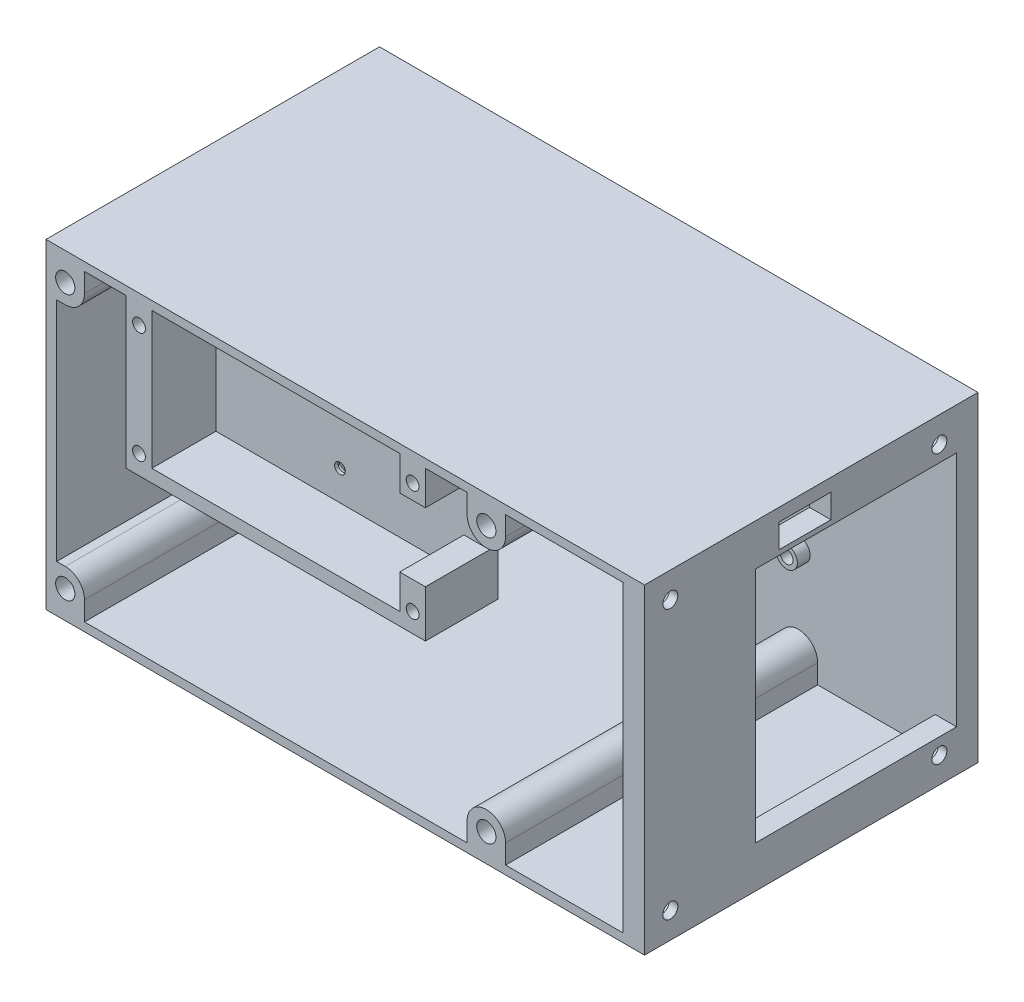
from build123d import *

# Parameters (mm, degrees)
SZKIC1_W                         = 140
SZKIC1_H                         = 75
SZKIC1_R                         = 2
SZKIC1_R_2                       = 1.5
DODANIE_WYCI_GNI_CIE1_DEPTH      = 5
SZKIC2_R                         = 2
SZKIC2_R_2                       = 1.5
WYTNIJ_WYCI_GNI_CIE1_DEPTH       = 3
SZKIC4_R                         = 4
SZKIC4_R_2                       = 2
SZKIC4_R_3                       = 2.5
SZKIC4_R_4                       = 1.5
DODANIE_WYCI_GNI_CIE3_DEPTH      = 3
SZKIC7_W                         = 140
SZKIC7_H                         = 75
DODANIE_WYCI_GNI_CIE5_DEPTH      = 73
WYTNIJ_WYCI_GNI_CIE2_REACH       = 178.943
SZKIC8_W                         = 47
SZKIC8_H                         = 55.5
SZKIC9_R                         = 2.25
WYTNIJ_WYCI_GNI_CIE3_DEPTH       = 177.943493805
WYTNIJ_WYCI_GNI_CIE4_DEPTH       = 47
SZKIC12_W                        = 70
SZKIC12_H                        = 2
DODANIE_WYCI_GNI_CIE6_DEPTH      = 35
SZKIC13_W                        = 6
SZKIC13_H                        = 8
DODANIE_WYCI_GNI_CIE7_DEPTH      = 15
WYTNIJ_WYCI_GNI_CIE5_REACH       = 172.863
SZKIC14_R                        = 1.25
WYTNIJ_WYCI_GNI_CIE6_START       = -1.2
SZKIC15_R                        = 1.25
WYTNIJ_WYCI_GNI_CIE6_DEPTH       = 1.2
WYTNIJ_WYCI_GNI_CIE7_REACH       = 178.943
SZKIC16_R                        = 1.5
WYTNIJ_WYCI_GNI_CIE8_START       = -13
SZKIC18_R                        = 1.5
WYTNIJ_WYCI_GNI_CIE8_DEPTH       = 13
WYTNIJ_WYCI_GNI_CIE9_REACH       = 178.943
SZKIC20_R                        = 1.75
WYTNIJ_WYCI_GNI_CIE10_DEPTH      = 5
WYTNIJ_WYCI_GNI_CIE10_DEPTH_BACK = 3
WYTNIJ_WYCI_GNI_CIE11_REACH      = 178.943
WYTNIJ_WYCI_GNI_CIE12_DEPTH      = 2.1
WYTNIJ_WYCI_GNI_CIE13_REACH      = 178.943
SZKIC24_W                        = 12.2
SZKIC24_H                        = 5.6


with BuildPart() as part:
    # Szkic1 → Dodanie-wyciągnięcie1 (new body)
    with BuildSketch(Plane.XY):
        with Locations((70, 37.5)):
            Rectangle(SZKIC1_W, SZKIC1_H)
        with Locations((6.6, 58.05)):
            Circle(SZKIC1_R, mode=Mode.SUBTRACT)
        with Locations((6.6, 16.95)):
            Circle(SZKIC1_R, mode=Mode.SUBTRACT)
        with Locations((69.3, 58.05)):
            Circle(SZKIC1_R, mode=Mode.SUBTRACT)
        with Locations((69.3, 16.95)):
            Circle(SZKIC1_R, mode=Mode.SUBTRACT)
        with Locations((90.54, 47.66)):
            Circle(SZKIC1_R_2, mode=Mode.SUBTRACT)
        with Locations(Location((103.24, 47.66, 0), (0, 0, 180))):
            Circle(SZKIC1_R_2, mode=Mode.SUBTRACT)
        with Locations((103.24, 27.34)):
            Circle(SZKIC1_R_2, mode=Mode.SUBTRACT)
        with Locations(Location((90.54, 27.34, 0), (0, 0, 180))):
            Circle(SZKIC1_R_2, mode=Mode.SUBTRACT)
    extrude(amount=DODANIE_WYCI_GNI_CIE1_DEPTH)

    # Szkic2 → Wytnij-wyciągnięcie1 (cut)
    # profile 1 of 8: a face of its own
    with BuildSketch(Plane(origin=(0, 0, 0), x_dir=(-1, 0, 0), z_dir=(0, 0, -1))):
        Polygon((-72.35, 59.810918321), (-69.3, 61.571836642), (-66.25, 59.810918321), (-66.25, 56.289081679), (-69.3, 54.528163358), (-72.35, 56.289081679), align=None)
        with Locations((-69.3, 58.05)):
            Circle(SZKIC2_R, mode=Mode.SUBTRACT)
    # profile 2 of 8: a face of its own
    with BuildSketch(Plane(origin=(0, 0, 0), x_dir=(-1, 0, 0), z_dir=(0, 0, -1))):
        Polygon((-6.6, 54.528163358), (-3.55, 56.289081679), (-3.55, 59.810918321), (-6.6, 61.571836642), (-9.65, 59.810918321), (-9.65, 56.289081679), align=None)
        with Locations((-6.6, 58.05)):
            Circle(SZKIC2_R, mode=Mode.SUBTRACT)
    # profile 3 of 8: a face of its own
    with BuildSketch(Plane(origin=(0, 0, 0), x_dir=(-1, 0, 0), z_dir=(0, 0, -1))):
        Polygon((-9.65, 18.710918321), (-6.6, 20.471836642), (-3.55, 18.710918321), (-3.55, 15.189081679), (-6.6, 13.428163358), (-9.65, 15.189081679), align=None)
        with Locations((-6.6, 16.95)):
            Circle(SZKIC2_R, mode=Mode.SUBTRACT)
    # profile 4 of 8: a face of its own
    with BuildSketch(Plane(origin=(0, 0, 0), x_dir=(-1, 0, 0), z_dir=(0, 0, -1))):
        Polygon((-69.3, 20.471836642), (-72.35, 18.710918321), (-72.35, 15.189081679), (-69.3, 13.428163358), (-66.25, 15.189081679), (-66.25, 18.710918321), align=None)
        with Locations((-69.3, 16.95)):
            Circle(SZKIC2_R, mode=Mode.SUBTRACT)
    # profile 5 of 8: a face of its own
    with BuildSketch(Plane(origin=(0, 0, 0), x_dir=(-1, 0, 0), z_dir=(0, 0, -1))):
        Polygon((-93.09, 49.132243186), (-90.54, 50.604486373), (-87.99, 49.132243186), (-87.99, 46.187756814), (-90.54, 44.715513627), (-93.09, 46.187756814), align=None)
        with Locations((-90.54, 47.66)):
            Circle(SZKIC2_R_2, mode=Mode.SUBTRACT)
    # profile 6 of 8: a face of its own
    with BuildSketch(Plane(origin=(0, 0, 0), x_dir=(-1, 0, 0), z_dir=(0, 0, -1))):
        Polygon((-103.24, 44.715513627), (-100.69, 46.187756814), (-100.69, 49.132243186), (-103.24, 50.604486373), (-105.79, 49.132243186), (-105.79, 46.187756814), align=None)
        with Locations((-103.24, 47.66)):
            Circle(SZKIC2_R_2, mode=Mode.SUBTRACT)
    # profile 7 of 8: a face of its own
    with BuildSketch(Plane(origin=(0, 0, 0), x_dir=(-1, 0, 0), z_dir=(0, 0, -1))):
        Polygon((-90.54, 30.284486373), (-93.09, 28.812243186), (-93.09, 25.867756814), (-90.54, 24.395513627), (-87.99, 25.867756814), (-87.99, 28.812243186), align=None)
        with Locations((-90.54, 27.34)):
            Circle(SZKIC2_R_2, mode=Mode.SUBTRACT)
    # profile 8 of 8: a face of its own
    with BuildSketch(Plane(origin=(0, 0, 0), x_dir=(-1, 0, 0), z_dir=(0, 0, -1))):
        Polygon((-105.79, 25.867756814), (-105.79, 28.812243186), (-103.24, 30.284486373), (-100.69, 28.812243186), (-100.69, 25.867756814), (-103.24, 24.395513627), align=None)
        with Locations((-103.24, 27.34)):
            Circle(SZKIC2_R_2, mode=Mode.SUBTRACT)
    extrude(amount=-WYTNIJ_WYCI_GNI_CIE1_DEPTH, mode=Mode.SUBTRACT)

    # Szkic4 → Dodanie-wyciągnięcie3 (add)
    # profile 1 of 8: a face of its own
    with BuildSketch(Plane.XY.offset(5)):
        with Locations(Location((6.6, 58.05, 0), (0, 0, 180))):
            Circle(SZKIC4_R)
        with Locations(Location((6.6, 58.05, 0), (0, 0, 180))):
            Circle(SZKIC4_R_2, mode=Mode.SUBTRACT)
    # profile 2 of 8: a face of its own
    with BuildSketch(Plane.XY.offset(5)):
        with Locations(Location((69.3, 58.05, 0), (0, 0, 180))):
            Circle(SZKIC4_R)
        with Locations(Location((69.3, 58.05, 0), (0, 0, 180))):
            Circle(SZKIC4_R_2, mode=Mode.SUBTRACT)
    # profile 3 of 8: a face of its own
    with BuildSketch(Plane.XY.offset(5)):
        with Locations(Location((6.6, 16.95, 0), (0, 0, 180))):
            Circle(SZKIC4_R)
        with Locations(Location((6.6, 16.95, 0), (0, 0, 180))):
            Circle(SZKIC4_R_2, mode=Mode.SUBTRACT)
    # profile 4 of 8: a face of its own
    with BuildSketch(Plane.XY.offset(5)):
        with Locations(Location((69.3, 16.95, 0), (0, 0, 180))):
            Circle(SZKIC4_R)
        with Locations(Location((69.3, 16.95, 0), (0, 0, 180))):
            Circle(SZKIC4_R_2, mode=Mode.SUBTRACT)
    # profile 5 of 8: a face of its own
    with BuildSketch(Plane.XY.offset(5)):
        with Locations(Location((90.54, 47.66, 0), (0, 0, 180))):
            Circle(SZKIC4_R_3)
        with Locations(Location((90.54, 47.66, 0), (0, 0, 180))):
            Circle(SZKIC4_R_4, mode=Mode.SUBTRACT)
    # profile 6 of 8: a face of its own
    with BuildSketch(Plane.XY.offset(5)):
        with Locations(Location((103.24, 47.66, 0), (0, 0, 180))):
            Circle(SZKIC4_R_3)
        with Locations(Location((103.24, 47.66, 0), (0, 0, 180))):
            Circle(SZKIC4_R_4, mode=Mode.SUBTRACT)
    # profile 7 of 8: a face of its own
    with BuildSketch(Plane.XY.offset(5)):
        with Locations(Location((90.54, 27.34, 0), (0, 0, 180))):
            Circle(SZKIC4_R_3)
        with Locations(Location((90.54, 27.34, 0), (0, 0, 180))):
            Circle(SZKIC4_R_4, mode=Mode.SUBTRACT)
    # profile 8 of 8: a face of its own
    with BuildSketch(Plane.XY.offset(5)):
        with Locations(Location((103.24, 27.34, 0), (0, 0, 180))):
            Circle(SZKIC4_R_3)
        with Locations(Location((103.24, 27.34, 0), (0, 0, 180))):
            Circle(SZKIC4_R_4, mode=Mode.SUBTRACT)
    extrude(amount=DODANIE_WYCI_GNI_CIE3_DEPTH)

    # Szkic7 → Dodanie-wyciągnięcie5 (add)
    with BuildSketch(Plane.XY.offset(5)):
        with Locations((70, 37.5)):
            Rectangle(SZKIC7_W, SZKIC7_H)
        with BuildLine():
            Line((2.5, 11), (2.5, 64))
            Line((2.5, 64), (4.5, 64))
            ThreePointArc((4.5, 64), (7.681980515, 65.318019485), (9, 68.5))
            Line((9, 68.5), (9, 73))
            Line((9, 73), (98.5, 73))
            Line((98.5, 73), (98.5, 68.5))
            ThreePointArc((98.5, 68.5), (103, 64), (107.5, 68.5))
            Line((107.5, 68.5), (107.5, 73))
            Line((107.5, 73), (135, 73))
            Line((135, 73), (135, 2))
            Line((135, 2), (107.5, 2))
            Line((107.5, 2), (107.5, 6.5))
            ThreePointArc((107.5, 6.5), (103, 11), (98.5, 6.5))
            Line((98.5, 6.5), (98.5, 2))
            Line((98.5, 2), (9, 2))
            Line((9, 2), (9, 6.5))
            ThreePointArc((9, 6.5), (7.681980515, 9.681980515), (4.5, 11))
            Line((4.5, 11), (2.5, 11))
        make_face(mode=Mode.SUBTRACT)
    extrude(amount=DODANIE_WYCI_GNI_CIE5_DEPTH)

    # Szkic8 → Wytnij-wyciągnięcie2 (cut, up to next)
    with BuildSketch(Plane(origin=(140, 0, 0), x_dir=(0, 0, -1), z_dir=(1, 0, 0)), mode=Mode.PRIVATE) as wytnij_wyci_gni_cie2_sk1:
        with Locations((-28.5, 37.5)):
            Rectangle(SZKIC8_W, SZKIC8_H)
    wytnij_wyci_gni_cie2_tool1 = extrude(wytnij_wyci_gni_cie2_sk1.sketch, amount=-WYTNIJ_WYCI_GNI_CIE2_REACH, mode=Mode.PRIVATE) & part.part
    add(wytnij_wyci_gni_cie2_tool1.solids().sort_by_distance((140, 37.5, 28.5))[0], mode=Mode.SUBTRACT)

    # Szkic9 → Wytnij-wyciągnięcie3 (cut, through all)
    with BuildSketch(Plane.XY.offset(78)):
        with Locations((4.5, 68.5)):
            Circle(SZKIC9_R)
        with Locations((103, 68.5)):
            Circle(SZKIC9_R)
        with Locations((4.5, 6.5)):
            Circle(SZKIC9_R)
        with Locations((103, 6.5)):
            Circle(SZKIC9_R)
    extrude(amount=-WYTNIJ_WYCI_GNI_CIE3_DEPTH, mode=Mode.SUBTRACT)

    # Szkic10 → Wytnij-wyciągnięcie4 (cut)
    with BuildSketch(Plane(origin=(0, 0, 0), x_dir=(-1, 0, 0), z_dir=(0, 0, -1))):
        Polygon((-106.55, 70.549593456), (-103, 72.599186911), (-99.45, 70.549593456), (-99.45, 66.450406544), (-103, 64.400813089), (-106.55, 66.450406544), align=None)
        Polygon((-99.45, 8.549593456), (-103, 10.599186911), (-106.55, 8.549593456), (-106.55, 4.450406544), (-103, 2.400813089), (-99.45, 4.450406544), align=None)
        Polygon((-4.5, 64.400813089), (-0.95, 66.450406544), (-0.95, 70.549593456), (-4.5, 72.599186911), (-8.05, 70.549593456), (-8.05, 66.450406544), align=None)
        Polygon((-0.95, 4.450406544), (-4.5, 2.400813089), (-8.05, 4.450406544), (-8.05, 8.549593456), (-4.5, 10.599186911), (-0.95, 8.549593456), align=None)
    extrude(amount=-WYTNIJ_WYCI_GNI_CIE4_DEPTH, mode=Mode.SUBTRACT)

    # Szkic12 → Dodanie-wyciągnięcie6 (add)
    with BuildSketch(Plane.XZ.offset(-73)):
        with Locations((53.75, 62)):
            Rectangle(SZKIC12_W, SZKIC12_H)
    extrude(amount=DODANIE_WYCI_GNI_CIE6_DEPTH)

    # Szkic13 → Dodanie-wyciągnięcie7 (add)
    with BuildSketch(Plane.XY.offset(63)):
        Polygon((82.75, 49), (82.75, 41), (24.75, 41), (24.75, 73), (18.75, 73), (18.75, 38), (88.75, 38), (88.75, 49), align=None)
        with Locations((85.75, 69)):
            Rectangle(SZKIC13_W, SZKIC13_H)
    extrude(amount=DODANIE_WYCI_GNI_CIE7_DEPTH)

    # Szkic14 → Wytnij-wyciągnięcie5 (cut, up to next)
    with BuildSketch(Plane.XY.offset(63), mode=Mode.PRIVATE) as wytnij_wyci_gni_cie5_sk1:
        with Locations((53.75, 66)):
            Circle(SZKIC14_R)
    wytnij_wyci_gni_cie5_tool1 = extrude(wytnij_wyci_gni_cie5_sk1.sketch, amount=-WYTNIJ_WYCI_GNI_CIE5_REACH, mode=Mode.PRIVATE) & part.part
    # Szkic14 → Wytnij-wyciągnięcie5 (cut, up to next)
    with BuildSketch(Plane.XY.offset(63), mode=Mode.PRIVATE) as wytnij_wyci_gni_cie5_sk2:
        with Locations((53.75, 48)):
            Circle(SZKIC14_R)
    wytnij_wyci_gni_cie5_tool2 = extrude(wytnij_wyci_gni_cie5_sk2.sketch, amount=-WYTNIJ_WYCI_GNI_CIE5_REACH, mode=Mode.PRIVATE) & part.part
    add(wytnij_wyci_gni_cie5_tool1.solids().sort_by_distance((53.75, 66, 63))[0], mode=Mode.SUBTRACT)
    add(wytnij_wyci_gni_cie5_tool2.solids().sort_by_distance((53.75, 48, 63))[0], mode=Mode.SUBTRACT)

    # Szkic15 → Wytnij-wyciągnięcie6 (cut)
    # profile 1 of 2: a face of its own
    with BuildSketch(Plane(origin=(0, 0, 61), x_dir=(-1, 0, 0), z_dir=(0, 0, -1)).offset(WYTNIJ_WYCI_GNI_CIE6_START)):
        Polygon((-55.9, 46.758696921), (-55.9, 49.241303079), (-53.75, 50.482606158), (-51.6, 49.241303079), (-51.6, 46.758696921), (-53.75, 45.517393842), align=None)
        with Locations((-53.75, 48)):
            Circle(SZKIC15_R, mode=Mode.SUBTRACT)
    # profile 2 of 2: a face of its own
    with BuildSketch(Plane(origin=(0, 0, 61), x_dir=(-1, 0, 0), z_dir=(0, 0, -1)).offset(WYTNIJ_WYCI_GNI_CIE6_START)):
        Polygon((-55.9, 67.241303079), (-55.9, 64.758696921), (-53.75, 63.517393842), (-51.6, 64.758696921), (-51.6, 67.241303079), (-53.75, 68.482606158), align=None)
        with Locations(Location((-53.75, 66, 0), (0, 0, 180))):
            Circle(SZKIC15_R, mode=Mode.SUBTRACT)
    extrude(amount=WYTNIJ_WYCI_GNI_CIE6_DEPTH, mode=Mode.SUBTRACT)

    # Szkic16 → Wytnij-wyciągnięcie7 (cut, up to next)
    with BuildSketch(Plane.XY.offset(78), mode=Mode.PRIVATE) as wytnij_wyci_gni_cie7_sk1:
        with Locations((21.75, 68.5)):
            Circle(SZKIC16_R)
    wytnij_wyci_gni_cie7_tool1 = extrude(wytnij_wyci_gni_cie7_sk1.sketch, amount=-WYTNIJ_WYCI_GNI_CIE7_REACH, mode=Mode.PRIVATE) & part.part
    # Szkic16 → Wytnij-wyciągnięcie7 (cut, up to next)
    with BuildSketch(Plane.XY.offset(78), mode=Mode.PRIVATE) as wytnij_wyci_gni_cie7_sk2:
        with Locations((21.75, 42.5)):
            Circle(SZKIC16_R)
    wytnij_wyci_gni_cie7_tool2 = extrude(wytnij_wyci_gni_cie7_sk2.sketch, amount=-WYTNIJ_WYCI_GNI_CIE7_REACH, mode=Mode.PRIVATE) & part.part
    # Szkic16 → Wytnij-wyciągnięcie7 (cut, up to next)
    with BuildSketch(Plane.XY.offset(78), mode=Mode.PRIVATE) as wytnij_wyci_gni_cie7_sk3:
        with Locations((85.75, 42.5)):
            Circle(SZKIC16_R)
    wytnij_wyci_gni_cie7_tool3 = extrude(wytnij_wyci_gni_cie7_sk3.sketch, amount=-WYTNIJ_WYCI_GNI_CIE7_REACH, mode=Mode.PRIVATE) & part.part
    # Szkic16 → Wytnij-wyciągnięcie7 (cut, up to next)
    with BuildSketch(Plane.XY.offset(78), mode=Mode.PRIVATE) as wytnij_wyci_gni_cie7_sk4:
        with Locations((85.75, 68.5)):
            Circle(SZKIC16_R)
    wytnij_wyci_gni_cie7_tool4 = extrude(wytnij_wyci_gni_cie7_sk4.sketch, amount=-WYTNIJ_WYCI_GNI_CIE7_REACH, mode=Mode.PRIVATE) & part.part
    add(wytnij_wyci_gni_cie7_tool1.solids().sort_by_distance((21.75, 68.5, 78))[0], mode=Mode.SUBTRACT)
    add(wytnij_wyci_gni_cie7_tool2.solids().sort_by_distance((21.75, 42.5, 78))[0], mode=Mode.SUBTRACT)
    add(wytnij_wyci_gni_cie7_tool3.solids().sort_by_distance((85.75, 42.5, 78))[0], mode=Mode.SUBTRACT)
    add(wytnij_wyci_gni_cie7_tool4.solids().sort_by_distance((85.75, 68.5, 78))[0], mode=Mode.SUBTRACT)

    # Szkic18 → Wytnij-wyciągnięcie8 (cut)
    # profile 1 of 4: a face of its own
    with BuildSketch(Plane(origin=(0, 0, 61), x_dir=(-1, 0, 0), z_dir=(0, 0, -1)).offset(WYTNIJ_WYCI_GNI_CIE8_START)):
        Polygon((-24.25, 43.943375673), (-21.75, 45.386751346), (-19.25, 43.943375673), (-19.25, 41.056624327), (-21.75, 39.613248654), (-24.25, 41.056624327), align=None)
        with Locations(Location((-21.75, 42.5, 0), (0, 0, 180))):
            Circle(SZKIC18_R, mode=Mode.SUBTRACT)
    # profile 2 of 4: a face of its own
    with BuildSketch(Plane(origin=(0, 0, 61), x_dir=(-1, 0, 0), z_dir=(0, 0, -1)).offset(WYTNIJ_WYCI_GNI_CIE8_START)):
        Polygon((-24.25, 69.943375673), (-24.25, 67.056624327), (-21.75, 65.613248654), (-19.25, 67.056624327), (-19.25, 69.943375673), (-21.75, 71.386751346), align=None)
        with Locations(Location((-21.75, 68.5, 0), (0, 0, 180))):
            Circle(SZKIC18_R, mode=Mode.SUBTRACT)
    # profile 3 of 4: a face of its own
    with BuildSketch(Plane(origin=(0, 0, 61), x_dir=(-1, 0, 0), z_dir=(0, 0, -1)).offset(WYTNIJ_WYCI_GNI_CIE8_START)):
        Polygon((-83.25, 41.056624327), (-83.25, 43.943375673), (-85.75, 45.386751346), (-88.25, 43.943375673), (-88.25, 41.056624327), (-85.75, 39.613248654), align=None)
        with Locations(Location((-85.75, 42.5, 0), (0, 0, 180))):
            Circle(SZKIC18_R, mode=Mode.SUBTRACT)
    # profile 4 of 4: a face of its own
    with BuildSketch(Plane(origin=(0, 0, 61), x_dir=(-1, 0, 0), z_dir=(0, 0, -1)).offset(WYTNIJ_WYCI_GNI_CIE8_START)):
        Polygon((-83.25, 69.943375673), (-83.25, 67.056624327), (-85.75, 65.613248654), (-88.25, 67.056624327), (-88.25, 69.943375673), (-85.75, 71.386751346), align=None)
        with Locations(Location((-85.75, 68.5, 0), (0, 0, 180))):
            Circle(SZKIC18_R, mode=Mode.SUBTRACT)
    extrude(amount=WYTNIJ_WYCI_GNI_CIE8_DEPTH, mode=Mode.SUBTRACT)

    # Szkic20 → Wytnij-wyciągnięcie9 (cut, up to next)
    with BuildSketch(Plane(origin=(140, 0, 0), x_dir=(0, 0, -1), z_dir=(1, 0, 0)), mode=Mode.PRIVATE) as wytnij_wyci_gni_cie9_sk1:
        with Locations((-71.966251763, 68.966251763)):
            Circle(SZKIC20_R)
    wytnij_wyci_gni_cie9_tool1 = extrude(wytnij_wyci_gni_cie9_sk1.sketch, amount=-WYTNIJ_WYCI_GNI_CIE9_REACH, mode=Mode.PRIVATE) & part.part
    # Szkic20 → Wytnij-wyciągnięcie9 (cut, up to next)
    with BuildSketch(Plane(origin=(140, 0, 0), x_dir=(0, 0, -1), z_dir=(1, 0, 0)), mode=Mode.PRIVATE) as wytnij_wyci_gni_cie9_sk2:
        with Locations((-9.033748237, 68.966251763)):
            Circle(SZKIC20_R)
    wytnij_wyci_gni_cie9_tool2 = extrude(wytnij_wyci_gni_cie9_sk2.sketch, amount=-WYTNIJ_WYCI_GNI_CIE9_REACH, mode=Mode.PRIVATE) & part.part
    # Szkic20 → Wytnij-wyciągnięcie9 (cut, up to next)
    with BuildSketch(Plane(origin=(140, 0, 0), x_dir=(0, 0, -1), z_dir=(1, 0, 0)), mode=Mode.PRIVATE) as wytnij_wyci_gni_cie9_sk3:
        with Locations((-9.033748237, 6.033748237)):
            Circle(SZKIC20_R)
    wytnij_wyci_gni_cie9_tool3 = extrude(wytnij_wyci_gni_cie9_sk3.sketch, amount=-WYTNIJ_WYCI_GNI_CIE9_REACH, mode=Mode.PRIVATE) & part.part
    # Szkic20 → Wytnij-wyciągnięcie9 (cut, up to next)
    with BuildSketch(Plane(origin=(140, 0, 0), x_dir=(0, 0, -1), z_dir=(1, 0, 0)), mode=Mode.PRIVATE) as wytnij_wyci_gni_cie9_sk4:
        with Locations((-71.966251763, 6.033748237)):
            Circle(SZKIC20_R)
    wytnij_wyci_gni_cie9_tool4 = extrude(wytnij_wyci_gni_cie9_sk4.sketch, amount=-WYTNIJ_WYCI_GNI_CIE9_REACH, mode=Mode.PRIVATE) & part.part
    add(wytnij_wyci_gni_cie9_tool1.solids().sort_by_distance((140, 68.966252, 71.966252))[0], mode=Mode.SUBTRACT)
    add(wytnij_wyci_gni_cie9_tool2.solids().sort_by_distance((140, 68.966252, 9.033748))[0], mode=Mode.SUBTRACT)
    add(wytnij_wyci_gni_cie9_tool3.solids().sort_by_distance((140, 6.033748, 9.033748))[0], mode=Mode.SUBTRACT)
    add(wytnij_wyci_gni_cie9_tool4.solids().sort_by_distance((140, 6.033748, 71.966252))[0], mode=Mode.SUBTRACT)

    # Szkic21 → Wytnij-wyciągnięcie10 (cut, two sides: drawn at the far end of the back side and taken through both)
    with BuildSketch(Plane.ZY.offset(-135).offset(-WYTNIJ_WYCI_GNI_CIE10_DEPTH_BACK)):
        Polygon((68.966251763, 7.765799045), (71.966251763, 9.497849852), (74.966251763, 7.765799045), (74.966251763, 4.30169743), (71.966251763, 2.569646622), (68.966251763, 4.30169743), align=None)
        Polygon((71.966251763, 65.502150148), (74.966251763, 67.234200955), (74.966251763, 70.69830257), (71.966251763, 72.430353378), (68.966251763, 70.69830257), (68.966251763, 67.234200955), align=None)
        Polygon((6.033748237, 70.69830257), (9.033748237, 72.430353378), (12.033748237, 70.69830257), (12.033748237, 67.234200955), (9.033748237, 65.502150148), (6.033748237, 67.234200955), align=None)
        Polygon((6.033748237, 4.30169743), (9.033748237, 2.569646622), (12.033748237, 4.30169743), (12.033748237, 7.765799045), (9.033748237, 9.497849852), (6.033748237, 7.765799045), align=None)
    extrude(amount=WYTNIJ_WYCI_GNI_CIE10_DEPTH + WYTNIJ_WYCI_GNI_CIE10_DEPTH_BACK, mode=Mode.SUBTRACT)

    # Szkic22 → Wytnij-wyciągnięcie11 (cut, up to next)
    with BuildSketch(Plane.ZY, mode=Mode.PRIVATE) as wytnij_wyci_gni_cie11_sk1:
        with BuildLine():
            Line((19.7, 34.5), (19.7, 40.5))
            ThreePointArc((19.7, 40.5), (21.2, 42), (22.7, 40.5))
            Line((22.7, 40.5), (22.7, 34.5))
            ThreePointArc((22.7, 34.5), (21.2, 33), (19.7, 34.5))
        make_face()
    wytnij_wyci_gni_cie11_tool1 = extrude(wytnij_wyci_gni_cie11_sk1.sketch, amount=-WYTNIJ_WYCI_GNI_CIE11_REACH, mode=Mode.PRIVATE) & part.part
    add(wytnij_wyci_gni_cie11_tool1.solids().sort_by_distance((0, 37.5, 21.2))[0], mode=Mode.SUBTRACT)

    # Szkic23 → Wytnij-wyciągnięcie12 (cut)
    with BuildSketch(Plane.ZY):
        with BuildLine():
            Line((17.7, 40.5), (17.7, 34.5))
            ThreePointArc((17.7, 34.5), (21.2, 31), (24.7, 34.5))
            Line((24.7, 34.5), (24.7, 40.5))
            ThreePointArc((24.7, 40.5), (21.2, 44), (17.7, 40.5))
        make_face()
        with BuildLine():
            Line((22.7, 34.5), (22.7, 40.5))
            ThreePointArc((22.7, 40.5), (21.2, 42), (19.7, 40.5))
            Line((19.7, 40.5), (19.7, 34.5))
            ThreePointArc((19.7, 34.5), (21.2, 33), (22.7, 34.5))
        make_face(mode=Mode.SUBTRACT)
    extrude(amount=-WYTNIJ_WYCI_GNI_CIE12_DEPTH, mode=Mode.SUBTRACT)

    # Szkic24 → Wytnij-wyciągnięcie13 (cut, up to next)
    with BuildSketch(Plane(origin=(140, 0, 0), x_dir=(0, 0, -1), z_dir=(1, 0, 0)), mode=Mode.PRIVATE) as wytnij_wyci_gni_cie13_sk1:
        with Locations((-40.5, 69.2)):
            Rectangle(SZKIC24_W, SZKIC24_H)
    wytnij_wyci_gni_cie13_tool1 = extrude(wytnij_wyci_gni_cie13_sk1.sketch, amount=-WYTNIJ_WYCI_GNI_CIE13_REACH, mode=Mode.PRIVATE) & part.part
    add(wytnij_wyci_gni_cie13_tool1.solids().sort_by_distance((140, 69.2, 40.5))[0], mode=Mode.SUBTRACT)


solid = part.part
